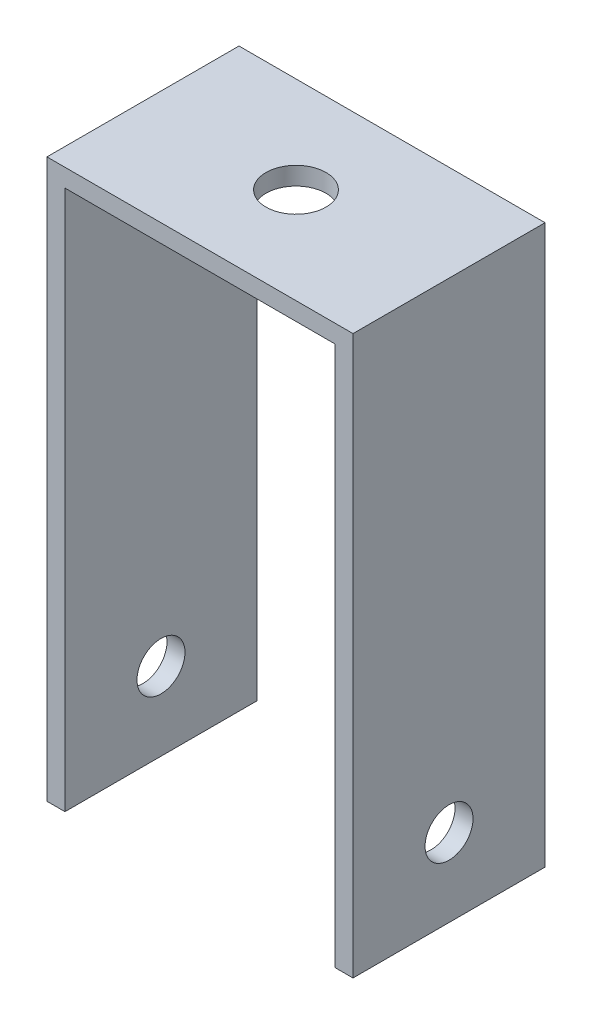
from build123d import *

# Parameters (mm, degrees)
BOSS_EXTRUDE1_DEPTH = 16
SKETCH2_R           = 4
CUT_EXTRUDE1_DEPTH  = 108.266024444
SKETCH3_R           = 5
CUT_EXTRUDE2_DEPTH  = 10


with BuildPart() as part:
    # Sketch1 → Boss-Extrude1 (new, symmetric)
    with BuildSketch(Plane.XY):
        Polygon((-25.5, 0), (25.5, 0), (25.5, -93), (22.5, -93), (22.5, -3), (-22.5, -3), (-22.5, -93), (-25.5, -93), align=None)
    extrude(amount=BOSS_EXTRUDE1_DEPTH, both=True)

    # Sketch2 → Cut-Extrude1 (cut, through all)
    with BuildSketch(Plane(origin=(25.5, 0, 0), x_dir=(0, 0, -1), z_dir=(1, 0, 0))):
        with Locations((0, -80)):
            Circle(SKETCH2_R)
    extrude(amount=-CUT_EXTRUDE1_DEPTH, mode=Mode.SUBTRACT)

    # Sketch3 → Cut-Extrude2 (cut)
    with BuildSketch(Plane(origin=(0, 0, 0), x_dir=(1, 0, 0), z_dir=(0, 1, 0))):
        with Locations(Location((0, 0, 0), (0, 0, 270))):
            Circle(SKETCH3_R)
    extrude(amount=-CUT_EXTRUDE2_DEPTH, mode=Mode.SUBTRACT)


solid = part.part
